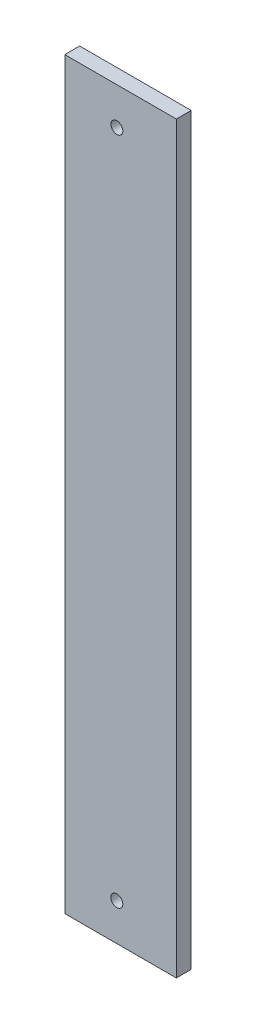
from build123d import *

# Parameters (mm, degrees)
SKETCH1_W             = 75
SKETCH1_H             = 500
BOSS_EXTRUDE1_DEPTH   = 10
F_8_0MM_DOWEL_HOLE1_D = 8


with BuildPart() as part:
    # Sketch1 → Boss-Extrude1 (new body)
    with BuildSketch(Plane.XY):
        with Locations((37.5, 250)):
            Rectangle(SKETCH1_W, SKETCH1_H)
    extrude(amount=BOSS_EXTRUDE1_DEPTH)

    # Ø8.0mm Dowel Hole1 (through all)
    with Locations(Plane.XY.offset(10)):
        with Locations((35, 25), (35, 475)):
            Hole(F_8_0MM_DOWEL_HOLE1_D / 2)


solid = part.part
